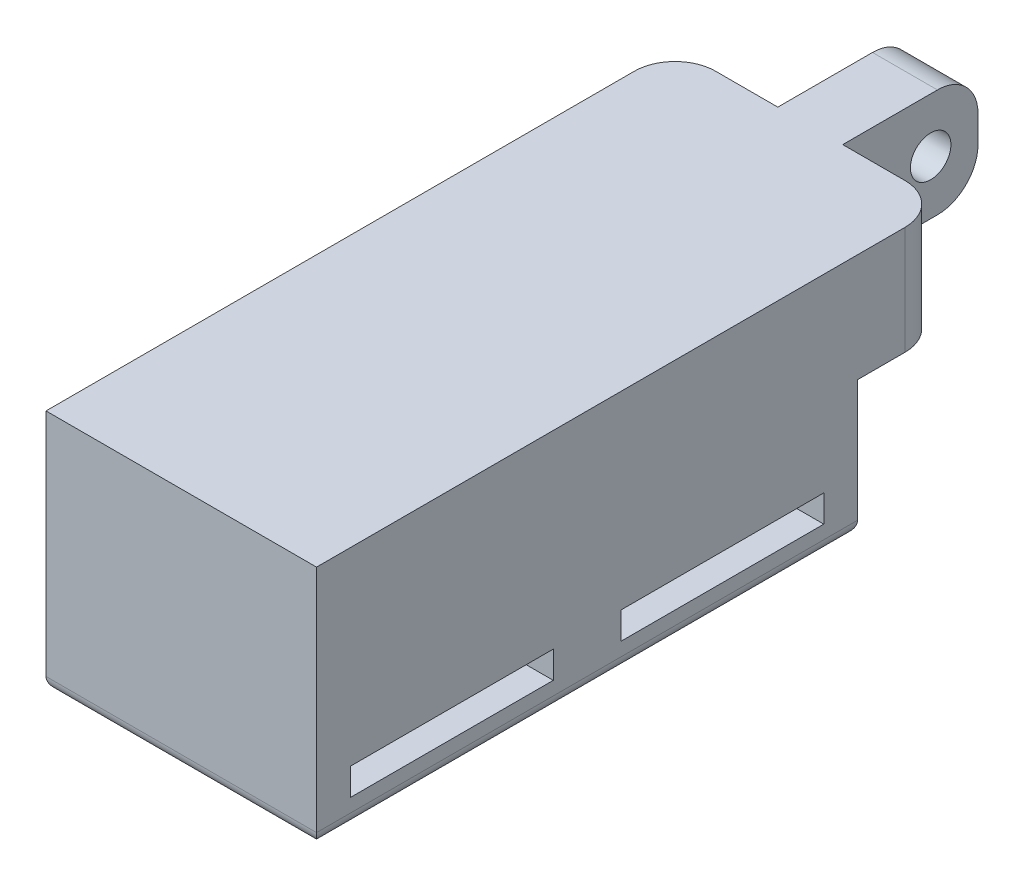
from build123d import *

# Parameters (mm, degrees)
CROQUIS1_R                 = 1.5
SALIENTE_EXTRUIR1_DEPTH    = 10
CORTAR_EXTRUIR1_DEPTH      = 60.539902586
CORTAR_EXTRUIR1_DEPTH_BACK = 60.539902586
CROQUIS2_W                 = 7.6
CROQUIS2_H                 = 10
CORTAR_EXTRUIR4_DEPTH      = 60.539902586
CORTAR_EXTRUIR4_DEPTH_BACK = 60.539902586
CROQUIS4_W                 = 15
CROQUIS4_H                 = 2
REDONDEO2_R                = 1
REDONDEO3_R                = 3


with BuildPart() as part:
    # Croquis1 → Saliente-Extruir1 (new, symmetric)
    with BuildSketch(Plane(origin=(0, 0, 0), x_dir=(0, 0, -1), z_dir=(1, 0, 0))):
        Polygon((-1.5, 9), (-58, 9), (-58, -9), (-18, -9), (-18, 1), (-1.5, 1), align=None)
        with Locations((-5, 5)):
            Circle(CROQUIS1_R, mode=Mode.SUBTRACT)
    extrude(amount=SALIENTE_EXTRUIR1_DEPTH, both=True)

    # Croquis2 → Cortar-Extruir1 (cut, two sides: drawn at the far end of the back side and taken through both)
    with BuildSketch(Plane(origin=(0, 0, 0), x_dir=(1, 0, 0), z_dir=(0, 1, 0)).offset(-CORTAR_EXTRUIR1_DEPTH_BACK)):
        with Locations((-6.2, -6.5)):
            Rectangle(CROQUIS2_W, CROQUIS2_H)
        with Locations((6.2, -6.5)):
            Rectangle(CROQUIS2_W, CROQUIS2_H)
    extrude(amount=CORTAR_EXTRUIR1_DEPTH + CORTAR_EXTRUIR1_DEPTH_BACK, mode=Mode.SUBTRACT)

    # Croquis4 → Cortar-Extruir4 (cut, two sides: drawn at the far end of the back side and taken through both)
    with BuildSketch(Plane(origin=(0, 0, 0), x_dir=(0, 0, -1), z_dir=(1, 0, 0)).offset(-CORTAR_EXTRUIR4_DEPTH_BACK)):
        with Locations((-48, -6)):
            Rectangle(CROQUIS4_W, CROQUIS4_H)
        with Locations((-28, -6)):
            Rectangle(CROQUIS4_W, CROQUIS4_H)
    extrude(amount=CORTAR_EXTRUIR4_DEPTH + CORTAR_EXTRUIR4_DEPTH_BACK, mode=Mode.SUBTRACT)

    # Redondeo2
    redondeo2_edges = [part.edges().sort_by_distance(p)[0] for p in [
        (0, -9, 18),
        (0, -9, 58),
        (-10, -9, 38),
        (10, -9, 38),
    ]]
    fillet(redondeo2_edges, radius=REDONDEO2_R)

    # Redondeo3
    redondeo3_edges = [part.edges().sort_by_distance(p)[0] for p in [
        (0, 9, 1.5),
        (0, 1, 1.5),
        (-10, 5, 11.5),
        (10, 5, 11.5),
    ]]
    fillet(redondeo3_edges, radius=REDONDEO3_R)


solid = part.part
